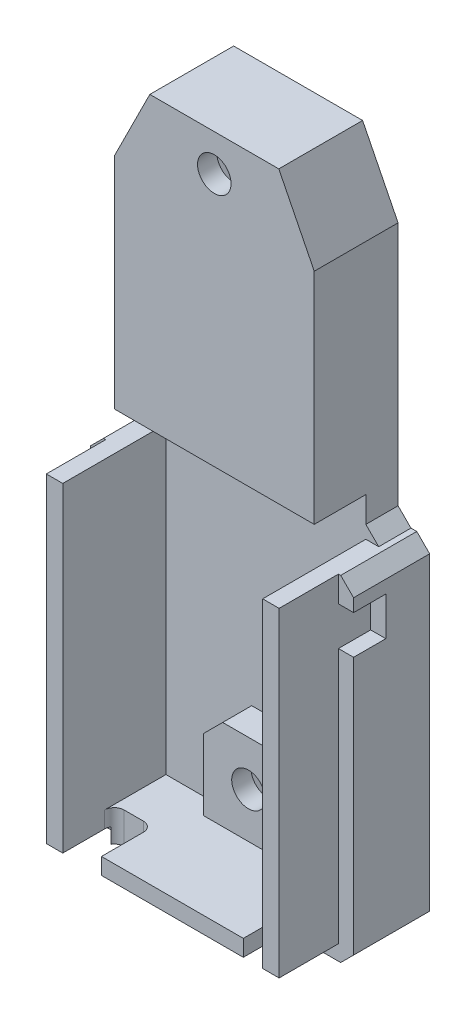
from build123d import *

# Parameters (mm, degrees)
SKETCH1_R           = 1.3
BOSS_EXTRUDE1_DEPTH = 2.5
SKETCH2_R           = 1.3
BOSS_EXTRUDE2_DEPTH = 4
SKETCH3_R           = 1.3
BOSS_EXTRUDE3_DEPTH = 2.25
CUT_EXTRUDE1_DEPTH  = 5
CUT_EXTRUDE2_DEPTH  = 3.25
BOSS_EXTRUDE4_DEPTH = 8
CUT_EXTRUDE3_REACH  = 55.54
CUT_EXTRUDE4_DEPTH  = 4.6
CHAMFER1_SIZE       = 1
SKETCH10_W          = 2.8
SKETCH10_H          = 2.8
CUT_EXTRUDE6_DEPTH  = 1.95
SKETCH12_W          = 1.175
SKETCH12_H          = 3
CUT_EXTRUDE7_DEPTH  = 2.5
BOSS_EXTRUDE6_START = 1.175
BOSS_EXTRUDE6_DEPTH = 1.175


with BuildPart() as part:
    # Sketch1 → Boss-Extrude1 (new body)
    with BuildSketch(Plane.XY):
        Polygon((-5, 25.75), (5, 25.75), (7.75, 20.25), (7.75, 0.25), (10.2, 0.25), (10.2, -25.75), (-10.2, -25.75), (-10.2, 0.25), (-7.75, 0.25), (-7.75, 20.25), align=None)
        with Locations((0, 22.9)):
            Circle(SKETCH1_R, mode=Mode.SUBTRACT)
        with Locations((0.9, -18.85)):
            Circle(SKETCH1_R, mode=Mode.SUBTRACT)
    extrude(amount=BOSS_EXTRUDE1_DEPTH)

    # Sketch2 → Boss-Extrude2 (add)
    with BuildSketch(Plane.XY.offset(2.5)):
        Polygon((-7.75, 3.25), (7.75, 3.25), (7.75, 20.25), (5, 25.75), (-5, 25.75), (-7.75, 20.25), align=None)
        with Locations((0, 22.9)):
            Circle(SKETCH2_R, mode=Mode.SUBTRACT)
    extrude(amount=BOSS_EXTRUDE2_DEPTH)

    # Sketch3 → Boss-Extrude3 (add)
    with BuildSketch(Plane.XY.offset(2.5)):
        Polygon((-1.1, -15.35), (2.9, -15.35), (4.4, -16.85), (4.4, -22.35), (-2.6, -22.35), (-2.6, -16.85), align=None)
        with Locations((0.9, -18.85)):
            Circle(SKETCH3_R, mode=Mode.SUBTRACT)
    extrude(amount=BOSS_EXTRUDE3_DEPTH)

    # Sketch4 → Cut-Extrude1 (cut)
    with BuildSketch(Plane(origin=(0, 0, 0), x_dir=(-1, 0, 0), z_dir=(0, 0, -1))):
        Polygon((2.915618859, 22.9), (1.45780943, 25.425), (-1.45780943, 25.425), (-2.915618859, 22.9), (-1.45780943, 20.375), (1.45780943, 20.375), align=None)
    extrude(amount=-CUT_EXTRUDE1_DEPTH, mode=Mode.SUBTRACT)

    # Sketch5 → Cut-Extrude2 (cut)
    with BuildSketch(Plane(origin=(0, 0, 0), x_dir=(-1, 0, 0), z_dir=(0, 0, -1))):
        Polygon((2.015618859, -18.85), (0.55780943, -16.325), (-2.35780943, -16.325), (-3.815618859, -18.85), (-2.35780943, -21.375), (0.55780943, -21.375), align=None)
    extrude(amount=-CUT_EXTRUDE2_DEPTH, mode=Mode.SUBTRACT)

    # Sketch6 → Boss-Extrude4 (add)
    with BuildSketch(Plane.XY.offset(2.5)):
        Polygon((-7.75, 0.25), (-10.2, 0.25), (-10.2, -25.75), (10.2, -25.75), (10.2, 0.25), (7.75, 0.25), (7.75, -23.3), (-7.75, -23.3), align=None)
    extrude(amount=BOSS_EXTRUDE4_DEPTH)

    # Sketch8 → Cut-Extrude3 (cut, up to next)
    with BuildSketch(Plane.XZ.offset(25.75), mode=Mode.PRIVATE) as cut_extrude3_sk1:
        with BuildLine():
            Line((-7.75, 10.5), (-7.75, 7.25))
            ThreePointArc((-7.75, 7.25), (-7.530330086, 6.719669914), (-7, 6.5))
            Line((-7, 6.5), (-5.5, 6.5))
            ThreePointArc((-5.5, 6.5), (-4.969669914, 6.719669914), (-4.75, 7.25))
            Line((-4.75, 7.25), (-4.75, 10.5))
            Line((-4.75, 10.5), (-7.75, 10.5))
        make_face()
    cut_extrude3_tool1 = extrude(cut_extrude3_sk1.sketch, amount=-CUT_EXTRUDE3_REACH, mode=Mode.PRIVATE) & part.part
    # Sketch8 → Cut-Extrude3 (cut, up to next)
    with BuildSketch(Plane.XZ.offset(25.75), mode=Mode.PRIVATE) as cut_extrude3_sk2:
        with BuildLine():
            Line((6.25, 10.5), (6.25, 7.25))
            ThreePointArc((6.25, 7.25), (7, 6.5), (7.75, 7.25))
            Line((7.75, 7.25), (7.75, 10.5))
            Line((7.75, 10.5), (6.25, 10.5))
        make_face()
    cut_extrude3_tool2 = extrude(cut_extrude3_sk2.sketch, amount=-CUT_EXTRUDE3_REACH, mode=Mode.PRIVATE) & part.part
    add(cut_extrude3_tool1.solids().sort_by_distance((-6.25, -25.75, 8.537624))[0], mode=Mode.SUBTRACT)
    add(cut_extrude3_tool2.solids().sort_by_distance((7, -25.75, 8.576826))[0], mode=Mode.SUBTRACT)

    # Sketch9 → Cut-Extrude4 (cut)
    with BuildSketch(Plane.XY.offset(10.5)):
        Polygon((-9.025, 0.25), (-10.2, 0.25), (-10.2, -25.75), (10.2, -25.75), (10.2, 0.25), (9.025, 0.25), (9.025, -24.575), (-9.025, -24.575), align=None)
    extrude(amount=-CUT_EXTRUDE4_DEPTH, mode=Mode.SUBTRACT)

    # Chamfer1
    chamfer1_edges = [part.edges().sort_by_distance(p)[0] for p in [
        (-7.75, 0.25, 1.25),
        (7.75, 0.25, 1.25),
        (-10.2, -25.75, 2.95),
        (-10.2, 0.25, 2.95),
        (10.2, 0.25, 2.95),
        (10.2, -25.75, 2.95),
    ]]
    chamfer(chamfer1_edges, length=CHAMFER1_SIZE)

    # Sketch10 → Cut-Extrude6 (cut)
    with BuildSketch(Plane.ZY.offset(10.2)):
        with Locations((2.95, -6.75)):
            Rectangle(SKETCH10_W, SKETCH10_H)
        with Locations((2.95, -18.75)):
            Rectangle(SKETCH10_W, SKETCH10_H)
    extrude(amount=-CUT_EXTRUDE6_DEPTH, mode=Mode.SUBTRACT)

    # Sketch12 → Cut-Extrude7 (cut)
    with BuildSketch(Plane.XY.offset(5.9)):
        with Locations((-9.6125, -3.25)):
            Rectangle(SKETCH12_W, SKETCH12_H)
        with Locations((9.6125, -3.25)):
            Rectangle(SKETCH12_W, SKETCH12_H)
    extrude(amount=-CUT_EXTRUDE7_DEPTH, mode=Mode.SUBTRACT)

    # Sketch13 → Boss-Extrude6 (add)
    with BuildSketch(Plane.XZ.offset(24.575).offset(BOSS_EXTRUDE6_START)):
        with BuildLine():
            Line((-7.65, 6.875834261), (-7.65, 5.9))
            Line((-7.65, 5.9), (-4.85, 5.9))
            Line((-4.85, 5.9), (-4.85, 6.875834261))
            ThreePointArc((-4.85, 6.875834261), (-5.124583101, 6.600721822), (-5.5, 6.5))
            Line((-5.5, 6.5), (-7, 6.5))
            ThreePointArc((-7, 6.5), (-7.375416899, 6.600721822), (-7.65, 6.875834261))
        make_face()
        with BuildLine():
            Line((6.35, 6.875834261), (6.35, 5.9))
            Line((6.35, 5.9), (7.65, 5.9))
            Line((7.65, 5.9), (7.65, 6.875834261))
            ThreePointArc((7.65, 6.875834261), (7, 6.5), (6.35, 6.875834261))
        make_face()
    extrude(amount=-BOSS_EXTRUDE6_DEPTH)


solid = part.part
